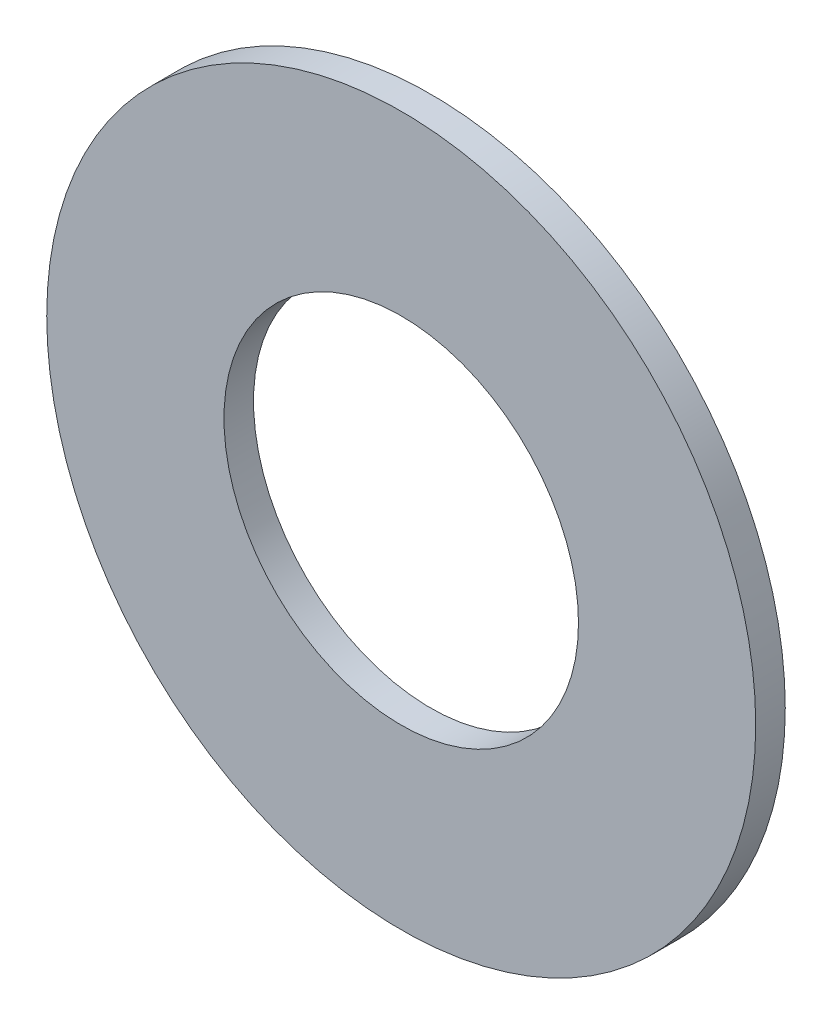
from build123d import *

# Parameters (mm, degrees)
SKETCH_1_R      = 6
SKETCH_1_R_2    = 3
EXTRUDE_1_DEPTH = 0.5


with BuildPart() as part:
    # 草图1 → 凸台-拉伸1 (new body)
    with BuildSketch(Plane.XY):
        Circle(SKETCH_1_R)
        Circle(SKETCH_1_R_2, mode=Mode.SUBTRACT)
    extrude(amount=EXTRUDE_1_DEPTH)


solid = part.part
